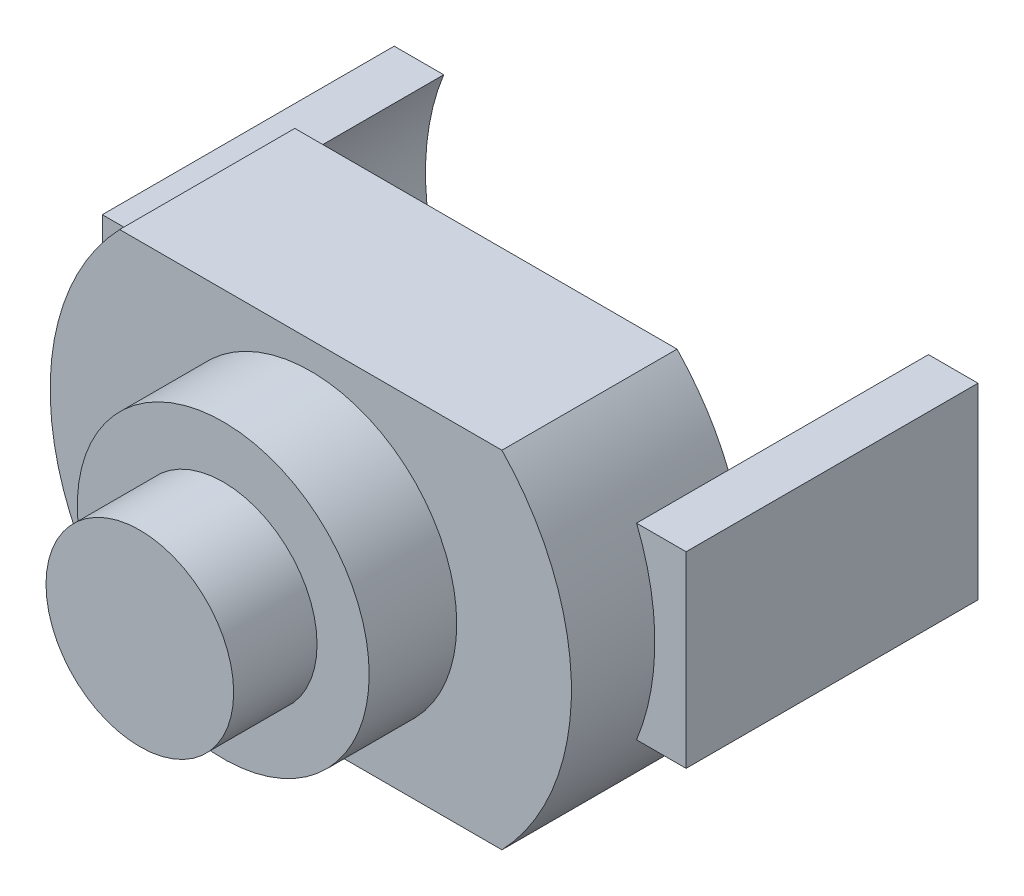
from build123d import *

# Parameters (mm, degrees)
EXTRUDE_1_DEPTH = 4.2
SKETCH_2_R      = 3.5
EXTRUDE_2_DEPTH = 2.1
SKETCH_3_R      = 2.25
EXTRUDE_3_DEPTH = 2
EXTRUDE_START   = -9
EXTRUDE_4_DEPTH = 7


with BuildPart() as part:
    # 草图1 → 凸台-拉伸1 (new body)
    with BuildSketch(Plane.XY):
        with BuildLine():
            ThreePointArc((-6.25, 3.3e-08), (-5.817755734, -2.236089463), (-4.583301282, -4.15))
            Line((-4.583301282, -4.15), (4.583301282, -4.15))
            ThreePointArc((4.583301282, -4.15), (5.817755724, -2.236089488), (6.25, -2.1e-08))
            ThreePointArc((6.25, -2.1e-08), (5.817755732, 2.236089469), (4.583301282, 4.15))
            Line((4.583301282, 4.15), (-4.583301282, 4.15))
            ThreePointArc((-4.583301282, 4.15), (-5.817755722, 2.236089494), (-6.25, 3.3e-08))
        make_face()
    extrude(amount=EXTRUDE_1_DEPTH)

    # 草图2 → 凸台-拉伸2 (add)
    with BuildSketch(Plane.XY.offset(4.2)):
        Circle(SKETCH_2_R)
    extrude(amount=EXTRUDE_2_DEPTH)

    # 草图3 → 凸台-拉伸3 (add)
    with BuildSketch(Plane.XY.offset(6.3)):
        Circle(SKETCH_3_R)
    extrude(amount=EXTRUDE_3_DEPTH)

    # 草图4 → 凸台-拉伸4 (add)
    with BuildSketch(Plane.XY.offset(4.2).offset(EXTRUDE_START)):
        with BuildLine():
            ThreePointArc((-5.812148865, -2.25), (-6.25, 0), (-5.812148865, 2.25))
            Line((-5.812148865, 2.25), (-7, 2.25))
            Line((-7, 2.25), (-7, -2.25))
            Line((-7, -2.25), (-5.812148865, -2.25))
        make_face()
        with BuildLine():
            Line((7, 2.25), (5.812148865, 2.25))
            ThreePointArc((5.812148865, 2.25), (6.25, 0), (5.812148865, -2.25))
            Line((5.812148865, -2.25), (7, -2.25))
            Line((7, -2.25), (7, 2.25))
        make_face()
    extrude(amount=EXTRUDE_4_DEPTH)


solid = part.part
